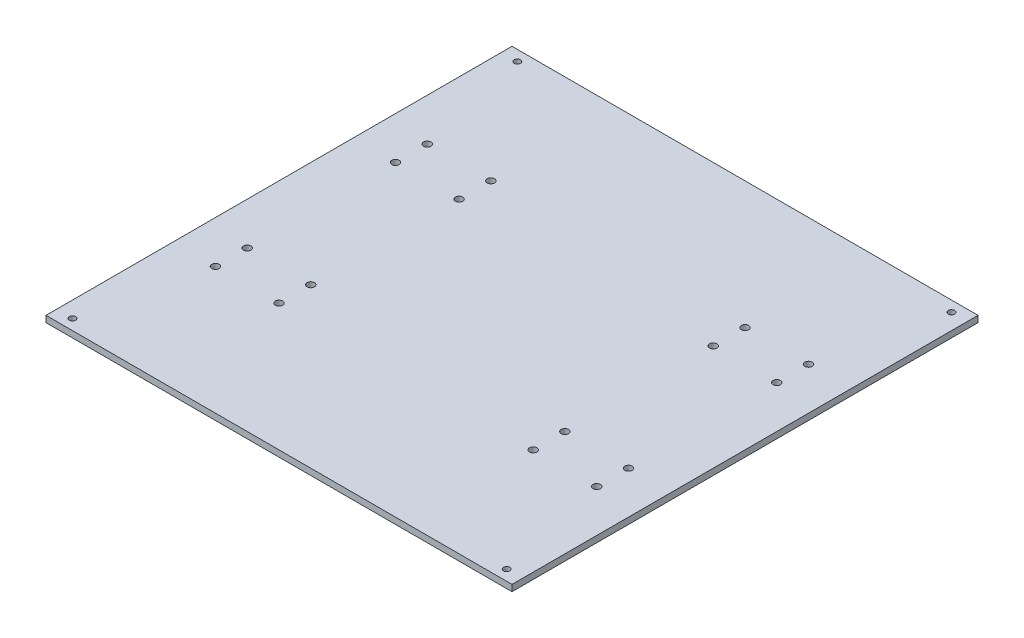
from build123d import *

# Parameters (mm, degrees)
ESBO_O1_W                = 220
ESBO_O1_H                = 220
ESBO_O1_R                = 1.5
ESBO_O1_R_2              = 1.75
RESSALTO_EXTRUS_O1_DEPTH = 3


with BuildPart() as part:
    # Esboço1 → Ressalto-extrusão1 (new body)
    with BuildSketch(Plane(origin=(0, 0, 0), x_dir=(1, 0, 0), z_dir=(0, 1, 0))):
        Rectangle(ESBO_O1_W, ESBO_O1_H)
        with Locations(Location((-102.5, 105, 0), (0, 0, 270))):
            Circle(ESBO_O1_R, mode=Mode.SUBTRACT)
        with Locations(Location((-102.5, -105, 0), (0, 0, 270))):
            Circle(ESBO_O1_R, mode=Mode.SUBTRACT)
        with Locations(Location((102.5, -105, 0), (0, 0, 90))):
            Circle(ESBO_O1_R, mode=Mode.SUBTRACT)
        with Locations(Location((102.5, 105, 0), (0, 0, 90))):
            Circle(ESBO_O1_R, mode=Mode.SUBTRACT)
        with Locations(Location((-90, 50, 0), (0, 0, 270))):
            Circle(ESBO_O1_R_2, mode=Mode.SUBTRACT)
        with Locations(Location((-60, 35, 0), (0, 0, 270))):
            Circle(ESBO_O1_R_2, mode=Mode.SUBTRACT)
        with Locations(Location((-90, 35, 0), (0, 0, 270))):
            Circle(ESBO_O1_R_2, mode=Mode.SUBTRACT)
        with Locations(Location((-60, 50, 0), (0, 0, 270))):
            Circle(ESBO_O1_R_2, mode=Mode.SUBTRACT)
        with Locations(Location((60, 50, 0), (0, 0, 90))):
            Circle(ESBO_O1_R_2, mode=Mode.SUBTRACT)
        with Locations(Location((90, 35, 0), (0, 0, 90))):
            Circle(ESBO_O1_R_2, mode=Mode.SUBTRACT)
        with Locations(Location((60, 35, 0), (0, 0, 90))):
            Circle(ESBO_O1_R_2, mode=Mode.SUBTRACT)
        with Locations(Location((90, 50, 0), (0, 0, 90))):
            Circle(ESBO_O1_R_2, mode=Mode.SUBTRACT)
        with Locations(Location((90, -50, 0), (0, 0, 270))):
            Circle(ESBO_O1_R_2, mode=Mode.SUBTRACT)
        with Locations(Location((60, -35, 0), (0, 0, 270))):
            Circle(ESBO_O1_R_2, mode=Mode.SUBTRACT)
        with Locations(Location((90, -35, 0), (0, 0, 270))):
            Circle(ESBO_O1_R_2, mode=Mode.SUBTRACT)
        with Locations(Location((60, -50, 0), (0, 0, 270))):
            Circle(ESBO_O1_R_2, mode=Mode.SUBTRACT)
        with Locations(Location((-60, -50, 0), (0, 0, 90))):
            Circle(ESBO_O1_R_2, mode=Mode.SUBTRACT)
        with Locations(Location((-90, -35, 0), (0, 0, 90))):
            Circle(ESBO_O1_R_2, mode=Mode.SUBTRACT)
        with Locations(Location((-60, -35, 0), (0, 0, 90))):
            Circle(ESBO_O1_R_2, mode=Mode.SUBTRACT)
        with Locations(Location((-90, -50, 0), (0, 0, 90))):
            Circle(ESBO_O1_R_2, mode=Mode.SUBTRACT)
    extrude(amount=RESSALTO_EXTRUS_O1_DEPTH)


solid = part.part
